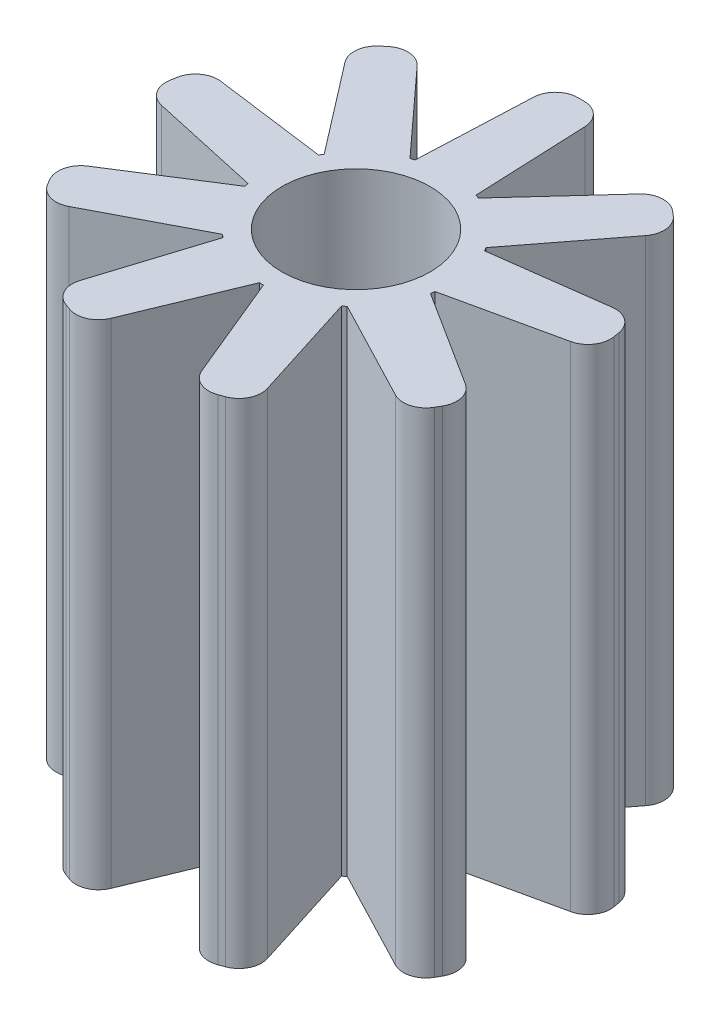
from build123d import *

# Parameters (mm, degrees)
ESBO_O1_R                = 0.9
RESSALTO_EXTRUS_O1_DEPTH = 6


with BuildPart() as part:
    # Esboço1 → Ressalto-extrusão1 (new body)
    with BuildSketch(Plane(origin=(0, 0, 0), x_dir=(1, 0, 0), z_dir=(0, 1, 0))):
        with BuildLine():
            Line((0.036455066, 2.733587387), (-0.036455066, 2.733587387))
            ThreePointArc((-0.036455066, 2.733587387), (-0.22673027, 2.657132964), (-0.311206342, 2.470280816))
            Line((-0.311206342, 2.470280816), (-0.37, 1.088852607))
            ThreePointArc((-0.37, 1.088852607), (-0.393323165, 1.080646514), (-0.416464521, 1.071940905))
            Line((-0.416464521, 1.071940905), (-1.349468012, 2.092384472))
            ThreePointArc((-1.349468012, 2.092384472), (-1.534286683, 2.181221351), (-1.729189902, 2.117482292))
            Line((-1.729189902, 2.117482292), (-1.785042303, 2.070616563))
            ThreePointArc((-1.785042303, 2.070616563), (-1.88165761, 1.889742534), (-1.826263789, 1.692305311))
            Line((-1.826263789, 1.692305311), (-0.983337409, 0.596278073))
            ThreePointArc((-0.983337409, 0.596278073), (-0.995929214, 0.575), (-1.008060664, 0.55345614))
            Line((-1.008060664, 0.55345614), (-2.378711285, 0.73543818))
            ThreePointArc((-2.378711285, 0.73543818), (-2.577393846, 0.684692025), (-2.685727696, 0.510583699))
            Line((-2.685727696, 0.510583699), (-2.698388408, 0.438781237))
            ThreePointArc((-2.698388408, 0.438781237), (-2.656136442, 0.238120569), (-2.486792113, 0.122481344))
            Line((-2.486792113, 0.122481344), (-1.136560315, -0.175301598))
            ThreePointArc((-1.136560315, -0.175301598), (-1.132528916, -0.199695404), (-1.127974019, -0.223996904))
            Line((-1.127974019, -0.223996904), (-2.294929112, -0.96562781))
            ThreePointArc((-2.294929112, -0.96562781), (-2.414509784, -1.132212308), (-2.385583653, -1.33522268))
            Line((-2.385583653, -1.33522268), (-2.349128587, -1.398364706))
            ThreePointArc((-2.349128587, -1.398364706), (-2.187779513, -1.524920656), (-1.98372277, -1.504653006))
            Line((-1.98372277, -1.504653006), (-0.757974019, -0.864855703))
            ThreePointArc((-0.757974019, -0.864855703), (-0.739205751, -0.88095111), (-0.720095794, -0.896639307))
            Line((-0.720095794, -0.896639307), (-1.137324101, -2.214865816))
            ThreePointArc((-1.137324101, -2.214865816), (-1.121849759, -2.41934192), (-0.969198506, -2.556263529))
            Line((-0.969198506, -2.556263529), (-0.900685394, -2.581200262))
            ThreePointArc((-0.900685394, -2.581200262), (-0.695736235, -2.574434559), (-0.552447496, -2.427743491))
            Line((-0.552447496, -2.427743491), (-0.024723255, -1.149734213))
            ThreePointArc((-0.024723255, -1.149734213), (0, -1.15), (0.024723255, -1.149734213))
            Line((0.024723255, -1.149734213), (0.552447496, -2.427743491))
            ThreePointArc((0.552447496, -2.427743491), (0.695736235, -2.574434559), (0.900685394, -2.581200262))
            Line((0.900685394, -2.581200262), (0.969198506, -2.556263529))
            ThreePointArc((0.969198506, -2.556263529), (1.121849759, -2.41934192), (1.137324101, -2.214865816))
            Line((1.137324101, -2.214865816), (0.720095794, -0.896639307))
            ThreePointArc((0.720095794, -0.896639307), (0.739205751, -0.88095111), (0.757974019, -0.864855703))
            Line((0.757974019, -0.864855703), (1.98372277, -1.504653006))
            ThreePointArc((1.98372277, -1.504653006), (2.187779513, -1.524920656), (2.349128587, -1.398364706))
            Line((2.349128587, -1.398364706), (2.385583653, -1.33522268))
            ThreePointArc((2.385583653, -1.33522268), (2.414509784, -1.132212308), (2.294929112, -0.96562781))
            Line((2.294929112, -0.96562781), (1.127974019, -0.223996904))
            ThreePointArc((1.127974019, -0.223996904), (1.132528916, -0.199695404), (1.136560315, -0.175301598))
            Line((1.136560315, -0.175301598), (2.486792113, 0.122481344))
            ThreePointArc((2.486792113, 0.122481344), (2.656136442, 0.238120569), (2.698388408, 0.438781237))
            Line((2.698388408, 0.438781237), (2.685727696, 0.510583699))
            ThreePointArc((2.685727696, 0.510583699), (2.577393846, 0.684692025), (2.378711285, 0.73543818))
            Line((2.378711285, 0.73543818), (1.008060664, 0.55345614))
            ThreePointArc((1.008060664, 0.55345614), (0.995929214, 0.575), (0.983337409, 0.596278073))
            Line((0.983337409, 0.596278073), (1.826263789, 1.692305311))
            ThreePointArc((1.826263789, 1.692305311), (1.88165761, 1.889742534), (1.785042303, 2.070616563))
            Line((1.785042303, 2.070616563), (1.729189902, 2.117482292))
            ThreePointArc((1.729189902, 2.117482292), (1.534286683, 2.181221351), (1.349468012, 2.092384472))
            Line((1.349468012, 2.092384472), (0.416464521, 1.071940905))
            ThreePointArc((0.416464521, 1.071940905), (0.393323165, 1.080646514), (0.37, 1.088852607))
            Line((0.37, 1.088852607), (0.311206342, 2.470280816))
            ThreePointArc((0.311206342, 2.470280816), (0.22673027, 2.657132964), (0.036455066, 2.733587387))
        make_face()
        Circle(ESBO_O1_R, mode=Mode.SUBTRACT)
    extrude(amount=RESSALTO_EXTRUS_O1_DEPTH)


solid = part.part
